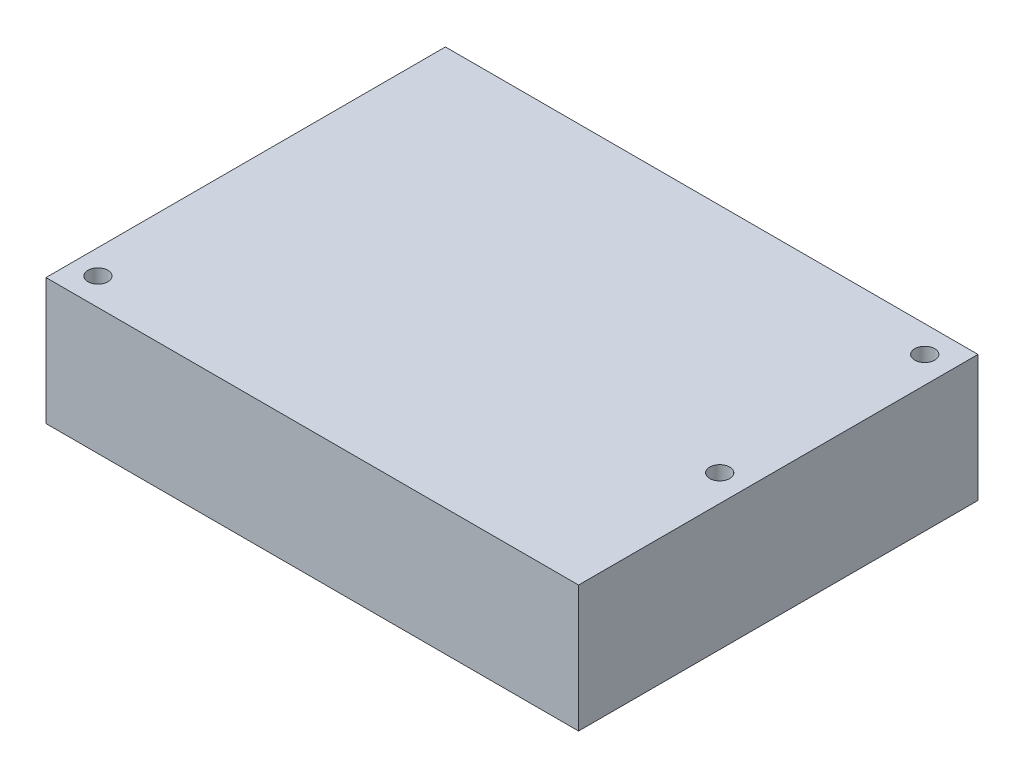
from build123d import *

# Parameters (mm, degrees)
SKETCH1_W           = 80
SKETCH1_H           = 60
SKETCH1_R           = 1.5
BOSS_EXTRUDE1_DEPTH = 19


with BuildPart() as part:
    # Sketch1 → Boss-Extrude1 (new body)
    with BuildSketch(Plane(origin=(0, 0, 0), x_dir=(1, 0, 0), z_dir=(0, 1, 0))):
        Rectangle(SKETCH1_W, SKETCH1_H)
        with Locations(Location((36, 26, 0), (0, 0, 270))):
            Circle(SKETCH1_R, mode=Mode.SUBTRACT)
        with Locations(Location((36, -4.8, 0), (0, 0, 270))):
            Circle(SKETCH1_R, mode=Mode.SUBTRACT)
        with Locations(Location((-36.3, -25.9, 0), (0, 0, 270))):
            Circle(SKETCH1_R, mode=Mode.SUBTRACT)
    extrude(amount=BOSS_EXTRUDE1_DEPTH)


solid = part.part
